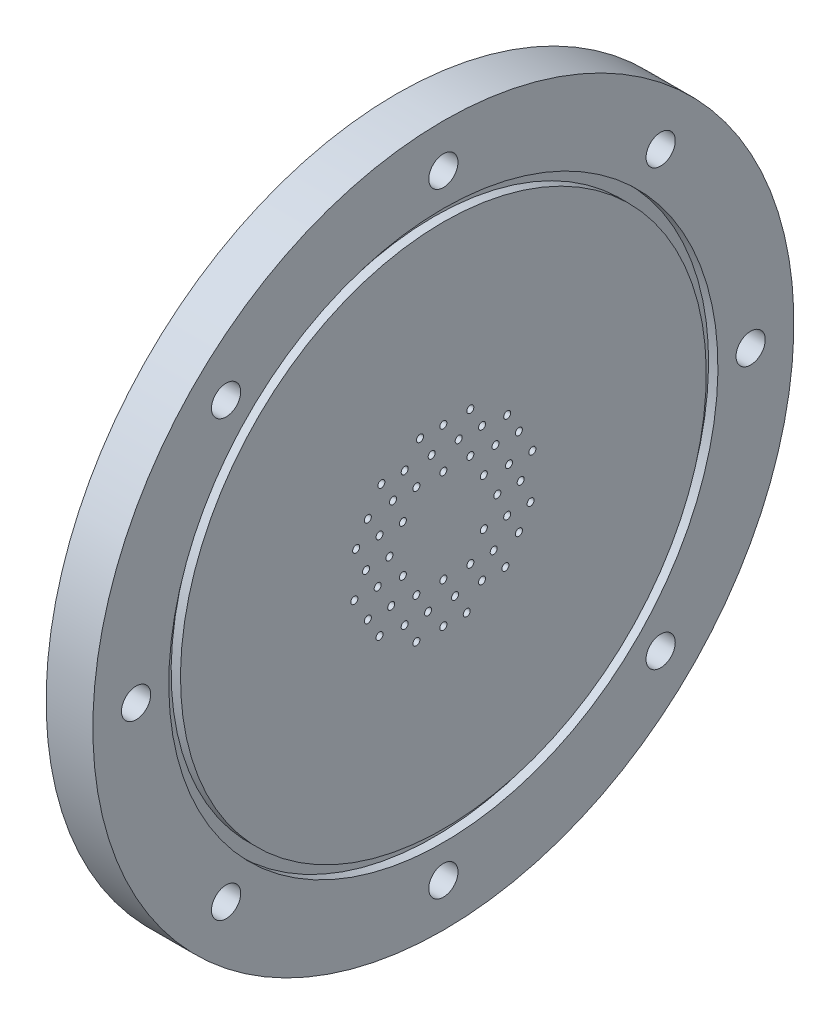
from build123d import *

# Parameters (mm, degrees)
SKETCH2_R          = 0.762
CUT_EXTRUDE1_DEPTH = 109.240960824
CIRPATTERN1_COUNT  = 6
SKETCH3_R          = 3.175
CUT_EXTRUDE2_DEPTH = 109.240960824
CIRPATTERN2_COUNT  = 8
SKETCH4_W          = 2.032
SKETCH4_H          = 2.54
SKETCH4_W_2        = 1.27
CHAMFER1_SIZE      = 0.508


with BuildPart() as part:
    # Sketch1 → Revolve1 (revolve)
    with BuildSketch(Plane.XY, mode=Mode.PRIVATE) as revolve1_sk:
        with BuildLine():
            Line((0, 0), (0, 48.26))
            ThreePointArc((0, 48.26), (-0.743948776, 50.056051224), (-2.54, 50.8))
            Line((-2.54, 50.8), (-6.35, 50.8))
            Line((-6.35, 50.8), (-6.35, 76.2))
            Line((-6.35, 76.2), (3.81, 76.2))
            Line((3.81, 76.2), (3.81, 0))
            Line((3.81, 0), (0, 0))
        make_face()
    revolve(revolve1_sk.sketch.rotate(Axis((-6.35, 0, 0), (1, 0, 0)), 180), axis=Axis((-6.35, 0, 0), (1, 0, 0)))

    # Sketch2 → Cut-Extrude1 (cut, through all)
    with BuildSketch(Plane(origin=(3.81, 0, 0), x_dir=(0, 0, -1), z_dir=(1, 0, 0))):
        with Locations(Location((0, 10.16, 0), (0, 0, 90))):
            Circle(SKETCH2_R)
        with Locations(Location((0, 18.958818102, 0), (0, 0, 90))):
            Circle(SKETCH2_R)
        with Locations(Location((5.865878735, 10.16, 0), (0, 0, 90))):
            Circle(SKETCH2_R)
        with Locations(Location((8.405878735, 14.559409051, 0), (0, 0, 90))):
            Circle(SKETCH2_R)
        with Locations(Location((-2.54, 14.559409051, 0), (0, 0, 90))):
            Circle(SKETCH2_R)
        with Locations(Location((5.865878735, 18.958818102, 0), (0, 0, 90))):
            Circle(SKETCH2_R)
        with Locations(Location((-5.08, 18.958818102, 0), (0, 0, 90))):
            Circle(SKETCH2_R)
        with Locations(Location((3.325878735, 14.559409051, 0), (0, 0, 90))):
            Circle(SKETCH2_R)
    cut_extrude1 = extrude(amount=-CUT_EXTRUDE1_DEPTH, mode=Mode.SUBTRACT)

    # CirPattern1: Cut-Extrude1 ×6 about axis
    cirpattern1_axis = Axis((0, 0, 0), (1, 0, 0))
    for i in range(1, CIRPATTERN1_COUNT):
        add(cut_extrude1.rotate(cirpattern1_axis, i * 360 / CIRPATTERN1_COUNT), mode=Mode.SUBTRACT)

    # Sketch3 → Cut-Extrude2 (cut, through all)
    with BuildSketch(Plane(origin=(3.81, 0, 0), x_dir=(0, 0, -1), z_dir=(1, 0, 0))):
        with Locations(Location((-66.802, 0, 0), (0, 0, 90))):
            Circle(SKETCH3_R)
    cut_extrude2 = extrude(amount=-CUT_EXTRUDE2_DEPTH, mode=Mode.SUBTRACT)

    # CirPattern2: Cut-Extrude2 ×8 about axis
    cirpattern2_axis = Axis((0, 0, 0), (1, 0, 0))
    for i in range(1, CIRPATTERN2_COUNT):
        add(cut_extrude2.rotate(cirpattern2_axis, i * 360 / CIRPATTERN2_COUNT), mode=Mode.SUBTRACT)

    # Sketch4 → Cut-Revolve1 (revolve, cut)
    with BuildSketch(Plane.XY):
        with Locations((2.794, 58.42)):
            Rectangle(SKETCH4_W, SKETCH4_H)
        with Locations((-5.334, 58.42)):
            Rectangle(SKETCH4_W, SKETCH4_H)
        with Locations((-5.715, 52.07)):
            Rectangle(SKETCH4_W_2, SKETCH4_H)
    revolve(axis=Axis((0, 0, 0), (-1, 0, 0)), mode=Mode.SUBTRACT)

    # Chamfer1
    chamfer1_edges = [part.edges().sort_by_distance(p)[0] for p in [
        (0, -4.699, -13.218906745),
        (0, -13.797409051, 3.325878735),
        (0, -18.196818102, -5.08),
        (0, -18.196818102, 5.865878735),
        (0, -13.797409051, 8.405878735),
        (0, -9.398, 5.865878735),
        (0, -18.196818102, 0),
        (0, -9.398, 0),
        (0, 9.098409051, -10.678906745),
        (0, -9.779, -10.285967377),
        (0, -4.699, -18.298906745),
        (0, -14.178409051, -12.825967377),
        (0, -4.699, -8.138906745),
        (0, -9.098409051, -15.758906745),
        (0, -9.779, -5.205967377),
        (0, -14.178409051, -7.745967377),
        (0, -9.098409051, 10.678906745),
        (0, 9.779, 10.285967377),
        (0, 4.699, 18.298906745),
        (0, 14.178409051, 12.825967377),
        (0, 4.699, 8.138906745),
        (0, 9.098409051, 15.758906745),
        (0, 9.779, 5.205967377),
        (0, 14.178409051, 7.745967377),
        (0, -4.018409051, 18.691846112),
        (0, -13.497818102, 13.218906745),
        (0, -4.018409051, 13.611846112),
        (0, -13.797409051, -2.54),
        (0, 0.381, 16.151846112),
        (0, 0.381, 11.071846112),
        (0, -9.098409051, 15.758906745),
        (0, -4.699, 8.138906745),
        (0, 4.018409051, -18.691846112),
        (0, 13.497818102, -13.218906745),
        (0, 4.018409051, -13.611846112),
        (0, -0.381, -16.151846112),
        (0, -0.381, -11.071846112),
        (0, 9.098409051, -15.758906745),
        (0, 4.699, -8.138906745),
        (0, 4.699, 13.218906745),
        (0, 9.398, 0),
        (0, 18.196818102, 0),
        (0, 9.398, -5.865878735),
        (0, 13.797409051, -8.405878735),
        (0, 18.196818102, -5.865878735),
        (0, 18.196818102, 5.08),
        (0, 13.797409051, -3.325878735),
        (0, 13.797409051, 2.54),
    ]]
    chamfer(chamfer1_edges, length=CHAMFER1_SIZE)


solid = part.part
